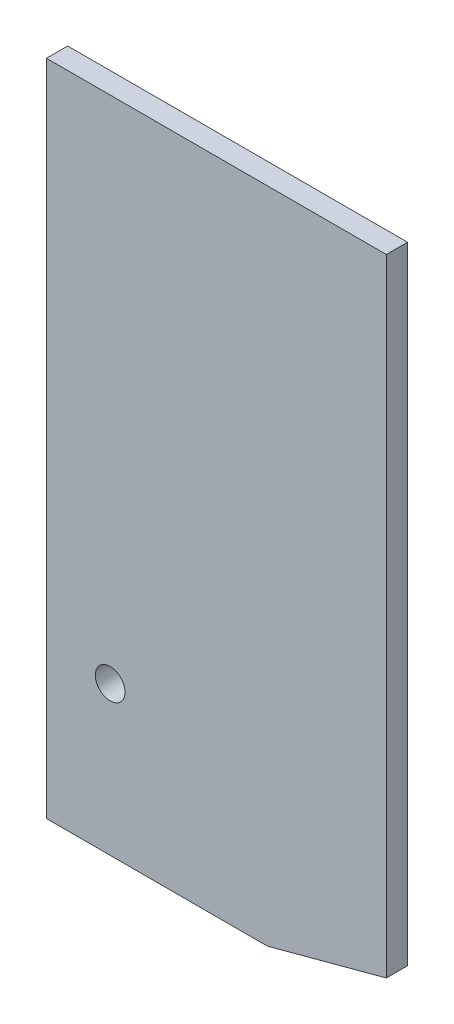
from build123d import *

# Parameters (mm, degrees)
ESQUISSE1_R        = 3.5
BOSS_EXTRU_1_DEPTH = 5


with BuildPart() as part:
    # Esquisse1 → Boss.-Extru.1 (new body)
    with BuildSketch(Plane.XY):
        Polygon((52.009618943, 0), (80, 7.5), (80, 155), (0, 155), (0, 0), align=None)
        with Locations((15, 35)):
            Circle(ESQUISSE1_R, mode=Mode.SUBTRACT)
    extrude(amount=BOSS_EXTRU_1_DEPTH)


solid = part.part
